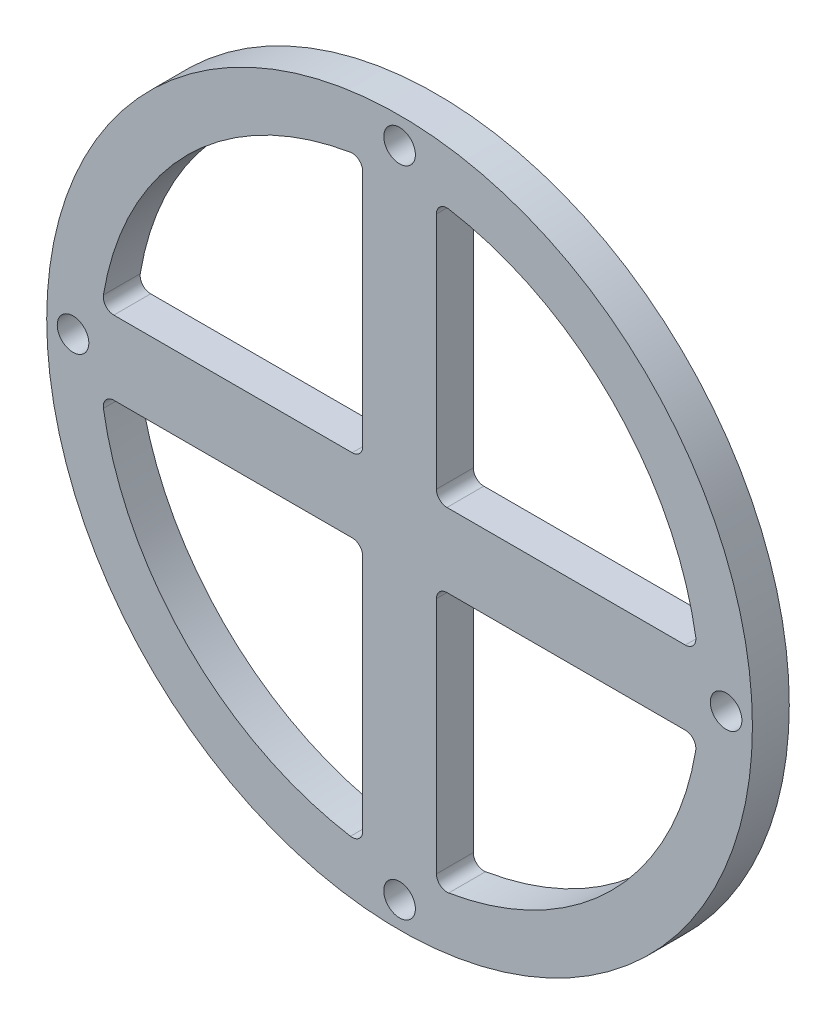
from build123d import *

# Parameters (mm, degrees)
SCHIZZO2_R                   = 67
ESTRUSIONE_ESTRUSIONE1_DEPTH = 7
SCHIZZO3_R                   = 3
TAGLIO_ESTRUSIONE2_DEPTH     = 7
RIPETIZIONECIRCOLARE1_COUNT  = 4


with BuildPart() as part:
    # Schizzo2 → Estrusione-Estrusione1 (new body)
    with BuildSketch(Plane.XY):
        Circle(SCHIZZO2_R)
        with BuildLine():
            Line((7, 9), (7, 54.258639865))
            ThreePointArc((7, 54.258639865), (7.706660419, 55.784180008), (9.327272727, 56.231681315))
            ThreePointArc((9.327272727, 56.231681315), (40.305086528, 40.305086528), (56.231681315, 9.327272727))
            ThreePointArc((56.231681315, 9.327272727), (55.784180008, 7.706660419), (54.258639865, 7))
            Line((54.258639865, 7), (9, 7))
            ThreePointArc((9, 7), (7.585786438, 7.585786438), (7, 9))
        make_face(mode=Mode.SUBTRACT)
        with BuildLine():
            Line((-9, 7), (-54.258639865, 7))
            ThreePointArc((-54.258639865, 7), (-55.784180008, 7.706660419), (-56.231681315, 9.327272727))
            ThreePointArc((-56.231681315, 9.327272727), (-40.305086528, 40.305086528), (-9.327272727, 56.231681315))
            ThreePointArc((-9.327272727, 56.231681315), (-7.706660419, 55.784180008), (-7, 54.258639865))
            Line((-7, 54.258639865), (-7, 9))
            ThreePointArc((-7, 9), (-7.585786438, 7.585786438), (-9, 7))
        make_face(mode=Mode.SUBTRACT)
        with BuildLine():
            Line((-9, -7), (-54.258639865, -7))
            ThreePointArc((-54.258639865, -7), (-55.784180008, -7.706660419), (-56.231681315, -9.327272727))
            ThreePointArc((-56.231681315, -9.327272727), (-40.305086528, -40.305086528), (-9.327272727, -56.231681315))
            ThreePointArc((-9.327272727, -56.231681315), (-7.706660419, -55.784180008), (-7, -54.258639865))
            Line((-7, -54.258639865), (-7, -9))
            ThreePointArc((-7, -9), (-7.585786438, -7.585786438), (-9, -7))
        make_face(mode=Mode.SUBTRACT)
        with BuildLine():
            Line((7, -54.258639865), (7, -9))
            ThreePointArc((7, -9), (7.585786438, -7.585786438), (9, -7))
            Line((9, -7), (54.258639865, -7))
            ThreePointArc((54.258639865, -7), (55.784180008, -7.706660419), (56.231681315, -9.327272727))
            ThreePointArc((56.231681315, -9.327272727), (40.305086528, -40.305086528), (9.327272727, -56.231681315))
            ThreePointArc((9.327272727, -56.231681315), (7.706660419, -55.784180008), (7, -54.258639865))
        make_face(mode=Mode.SUBTRACT)
    extrude(amount=ESTRUSIONE_ESTRUSIONE1_DEPTH)

    # Schizzo3 → Taglio-Estrusione2 (cut)
    with BuildSketch(Plane.XY):
        with Locations((0, 62)):
            Circle(SCHIZZO3_R)
    taglio_estrusione2 = extrude(amount=TAGLIO_ESTRUSIONE2_DEPTH, mode=Mode.SUBTRACT)

    # RipetizioneCircolare1: Taglio-Estrusione2 ×4 about axis
    ripetizionecircolare1_axis = Axis((0, 0, 0), (0, 0, 1))
    for i in range(1, RIPETIZIONECIRCOLARE1_COUNT):
        add(taglio_estrusione2.rotate(ripetizionecircolare1_axis, i * 360 / RIPETIZIONECIRCOLARE1_COUNT), mode=Mode.SUBTRACT)


solid = part.part
